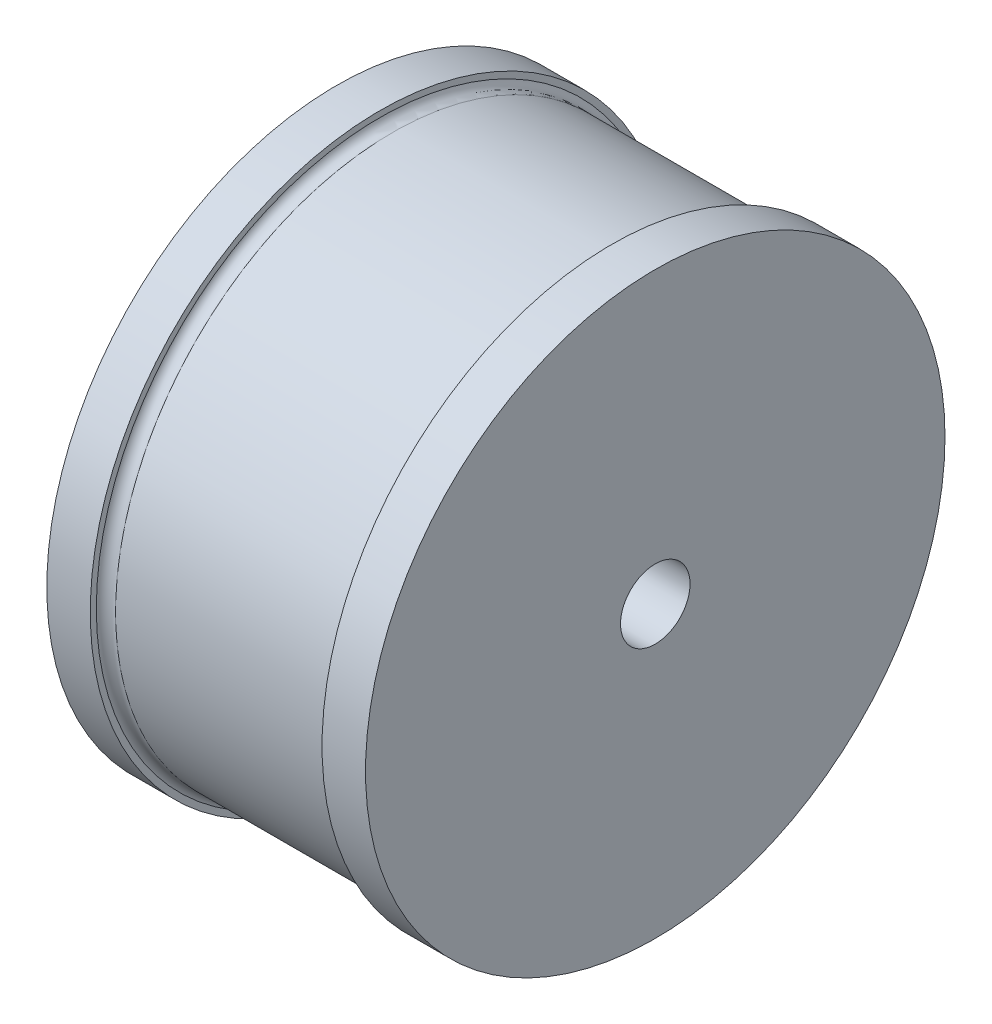
from build123d import *

# Parameters (mm, degrees)
SKETCH3_R          = 6
CUT_EXTRUDE1_DEPTH = 104.136405777


with BuildPart() as part:
    # Sketch1 → Revolve1 (revolve)
    with BuildSketch(Plane.XY, mode=Mode.PRIVATE) as revolve1_sk:
        with BuildLine():
            Line((23.876500295, 28.500921708), (23.876500295, -21.499078292))
            Line((23.876500295, -21.499078292), (19.38343903, -21.499078292))
            Line((19.38343903, -21.499078292), (-23.623499705, -21.499078292))
            Line((-23.623499705, -21.499078292), (-31.123499705, -21.499078292))
            Line((-31.123499705, -21.499078292), (-31.123499705, 20.226597036))
            Line((-31.123499705, 20.226597036), (-31.123499705, 28.500921708))
            Line((-31.123499705, 28.500921708), (-23.623499705, 28.500921708))
            Line((-23.623499705, 28.500921708), (-23.623499705, 27.45743453))
            ThreePointArc((-23.623499705, 27.45743453), (-22.782204784, 26.431489238), (-21.461866567, 26.300921708))
            Line((-21.461866567, 26.300921708), (-3.623499705, 26.300921708))
            Line((-3.623499705, 26.300921708), (14.814368071, 26.300921708))
            ThreePointArc((14.814368071, 26.300921708), (15.776775387, 26.633474133), (16.376500295, 27.456364765))
            Line((16.376500295, 27.456364765), (16.376500295, 28.500921708))
            Line((16.376500295, 28.500921708), (23.876500295, 28.500921708))
        make_face()
    revolve(revolve1_sk.sketch.rotate(Axis((23.876500295, -21.499078292, 0), (-1, 0, 0)), 90), axis=Axis((23.876500295, -21.499078292, 0), (-1, 0, 0)))

    # Sketch3 → Cut-Extrude1 (cut, through all)
    with BuildSketch(Plane(origin=(23.876500295, 0, 0), x_dir=(0, 0, -1), z_dir=(1, 0, 0))):
        with Locations((0, -21.499078292)):
            Circle(SKETCH3_R)
    extrude(amount=-CUT_EXTRUDE1_DEPTH, mode=Mode.SUBTRACT)


solid = part.part
